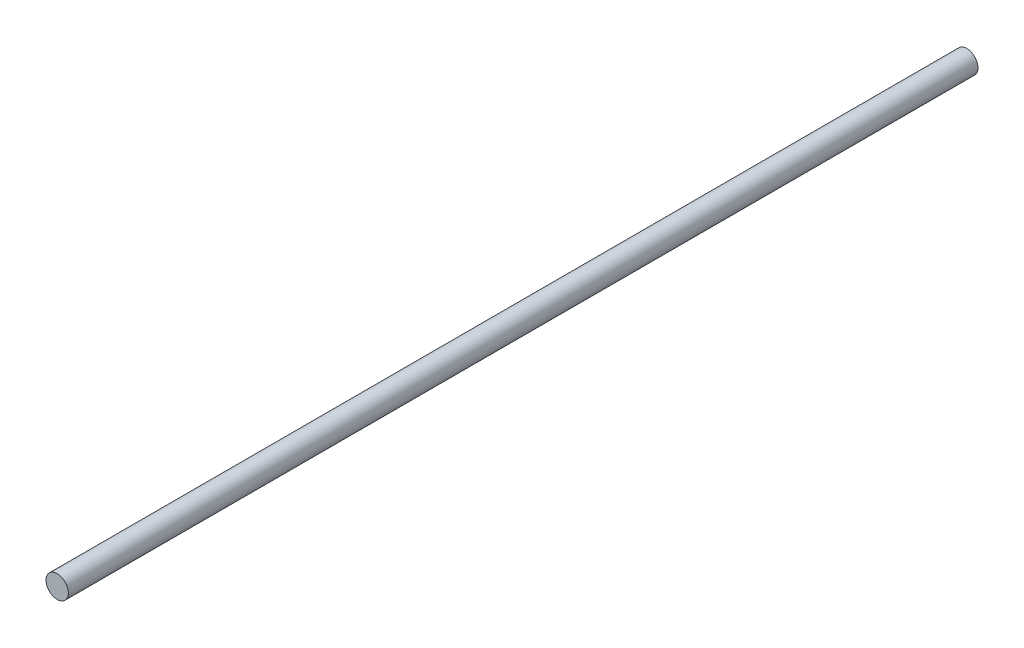
from build123d import *

# Parameters (mm, degrees)
SKETCH1_R           = 50.8
BOSS_EXTRUDE1_DEPTH = 4133.088


with BuildPart() as part:
    # Sketch1 → Boss-Extrude1 (new body)
    with BuildSketch(Plane.XY):
        Circle(SKETCH1_R)
    extrude(amount=BOSS_EXTRUDE1_DEPTH)


solid = part.part
